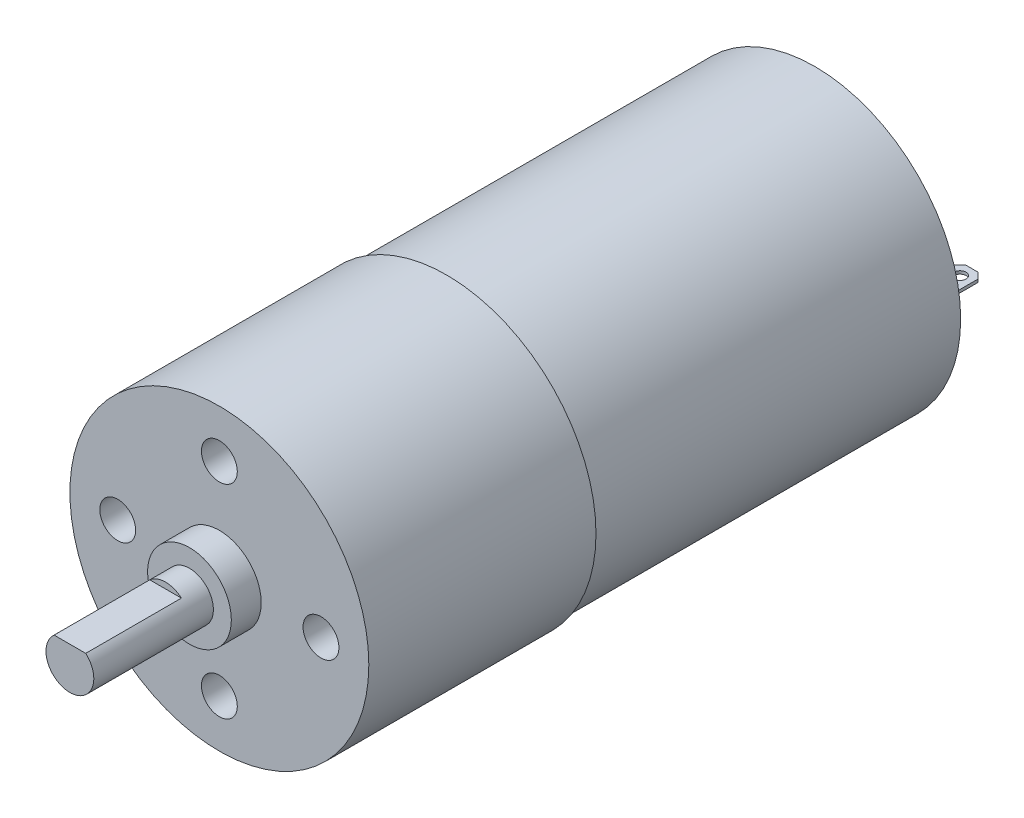
from build123d import *
from build123d.topology import SkipClean

# Parameters (mm, degrees)
SKETCH1_R                    = 12.5
BOSS_EXTRUDE1_DEPTH          = 19
SKETCH2_R                    = 12.2
BOSS_EXTRUDE2_DEPTH          = 30.8
SKETCH3_R                    = 1.5
CUT_EXTRUDE1_DEPTH           = 10
CIRPATTERN1_COUNT            = 4
SKETCH4_R                    = 3.5
BOSS_EXTRUDE3_DEPTH          = 2.5
BOSS_EXTRUDE4_DEPTH          = 10
SKETCH7_R                    = 2
BOSS_EXTRUDE5_DEPTH          = 2
SKETCH8_W                    = 2
SKETCH8_H                    = 0.25
BOSS_EXTRUDE6_DEPTH          = 4
CHAMFER1_SIZE                = 0.5
CUT_EXTRUDE2_REACH           = 58.658
SKETCH10_R                   = 0.5
CIRPATTERN2_COUNT            = 2
CHAMFER1_OF_CIRPATTERN2_SIZE = 0.5
BOSS_EXTRUDE7_START          = 1.5
SKETCH11_R                   = 3.5
BOSS_EXTRUDE7_DEPTH          = 1.5
FILLET1_R                    = 0.25


with BuildPart() as part:
    # Sketch1 → Boss-Extrude1 (new body)
    with BuildSketch(Plane.XY):
        Circle(SKETCH1_R)
    extrude(amount=-BOSS_EXTRUDE1_DEPTH)

    # Sketch2 → Boss-Extrude2 (add)
    with BuildSketch(Plane(origin=(0, 0, -19), x_dir=(-1, 0, 0), z_dir=(0, 0, -1))):
        Circle(SKETCH2_R)
    extrude(amount=BOSS_EXTRUDE2_DEPTH)

    # Sketch3 → Cut-Extrude1 (cut)
    with BuildSketch(Plane.XY):
        with Locations((-8.5, 0)):
            Circle(SKETCH3_R)
    cut_extrude1 = extrude(amount=-CUT_EXTRUDE1_DEPTH, mode=Mode.SUBTRACT)

    # CirPattern1: Cut-Extrude1 ×4 about axis
    cirpattern1_axis = Axis((0, 0, -19), (0, 0, 1))
    for i in range(1, CIRPATTERN1_COUNT):
        add(cut_extrude1.rotate(cirpattern1_axis, i * 360 / CIRPATTERN1_COUNT), mode=Mode.SUBTRACT)

    # Sketch4 → Boss-Extrude3 (add)
    with BuildSketch(Plane.XY):
        Circle(SKETCH4_R)
    extrude(amount=BOSS_EXTRUDE3_DEPTH)

    # Sketch6 → Boss-Extrude4 (add)
    with BuildSketch(Plane.XY.offset(2.5)):
        with BuildLine():
            Line((-1.322875656, 1.5), (1.322875656, 1.5))
            ThreePointArc((1.322875656, 1.5), (0, -2), (-1.322875656, 1.5))
        make_face()
    extrude(amount=BOSS_EXTRUDE4_DEPTH)

    # Sketch7 → Boss-Extrude5 (add)
    with SkipClean():  # the faces are left unmerged after this step: merging them gives an invalid solid
        with BuildSketch(Plane.XY.offset(2.5)):
            Circle(SKETCH7_R)
        extrude(amount=BOSS_EXTRUDE5_DEPTH)

    # Sketch8 → Boss-Extrude6 (add)
    with SkipClean():  # the faces are left unmerged after this step: merging them gives an invalid solid
        with BuildSketch(Plane(origin=(0, 0, -49.8), x_dir=(-1, 0, 0), z_dir=(0, 0, -1))):
            with Locations((-9.15, 0)):
                Rectangle(SKETCH8_W, SKETCH8_H)
        boss_extrude6 = extrude(amount=BOSS_EXTRUDE6_DEPTH)

    # Chamfer1
    chamfer1_edges = [part.edges().sort_by_distance(p)[0] for p in [
        (10.15, 0, -53.8),
        (8.15, 0, -53.8),
    ]]
    chamfer(chamfer1_edges, length=CHAMFER1_SIZE)

    # Sketch10 → Cut-Extrude2 (cut, up to next)
    with BuildSketch(Plane(origin=(0, 0.125, 0), x_dir=(1, 0, 0), z_dir=(0, 1, 0)), mode=Mode.PRIVATE) as cut_extrude2_sk1:
        with Locations((9.15, 52.8)):
            Circle(SKETCH10_R)
    cut_extrude2_tool1 = extrude(cut_extrude2_sk1.sketch, amount=-CUT_EXTRUDE2_REACH, mode=Mode.PRIVATE) & part.part
    cut_extrude2 = cut_extrude2_tool1.solids().sort_by_distance((9.15, 0.125, -52.8))[0]
    add(cut_extrude2, mode=Mode.SUBTRACT)

    # CirPattern2: Boss-Extrude6, Cut-Extrude2 ×2 about axis
    with SkipClean():  # the faces are left unmerged after this step: merging them gives an invalid solid
        cirpattern2_axis = Axis((0, 0, -19), (0, 0, 1))
        add([boss_extrude6.rotate(cirpattern2_axis, i * 360 / CIRPATTERN2_COUNT) for i in range(1, CIRPATTERN2_COUNT)])
        add([cut_extrude2.rotate(cirpattern2_axis, i * 360 / CIRPATTERN2_COUNT) for i in range(1, CIRPATTERN2_COUNT)], mode=Mode.SUBTRACT)

    # Chamfer1 of CirPattern2
    chamfer1_of_cirpattern2_edges = [part.edges().sort_by_distance(p)[0] for p in [
        (-10.15, 0, -53.8),
        (-8.15, 0, -53.8),
    ]]
    chamfer(chamfer1_of_cirpattern2_edges, length=CHAMFER1_OF_CIRPATTERN2_SIZE)

    # Sketch11 → Boss-Extrude7 (add)
    with SkipClean():  # the faces are left unmerged after this step: merging them gives an invalid solid
        with BuildSketch(Plane(origin=(0, 0, -49.8), x_dir=(-1, 0, 0), z_dir=(0, 0, -1)).offset(BOSS_EXTRUDE7_START)):
            Circle(SKETCH11_R)
        extrude(amount=-BOSS_EXTRUDE7_DEPTH)

    # Fillet1
    fillet1_edges = [part.edges().sort_by_distance(p)[0] for p in [
        (3.5, 0, -51.3),
    ]]
    fillet(fillet1_edges, radius=FILLET1_R)


solid = part.part
